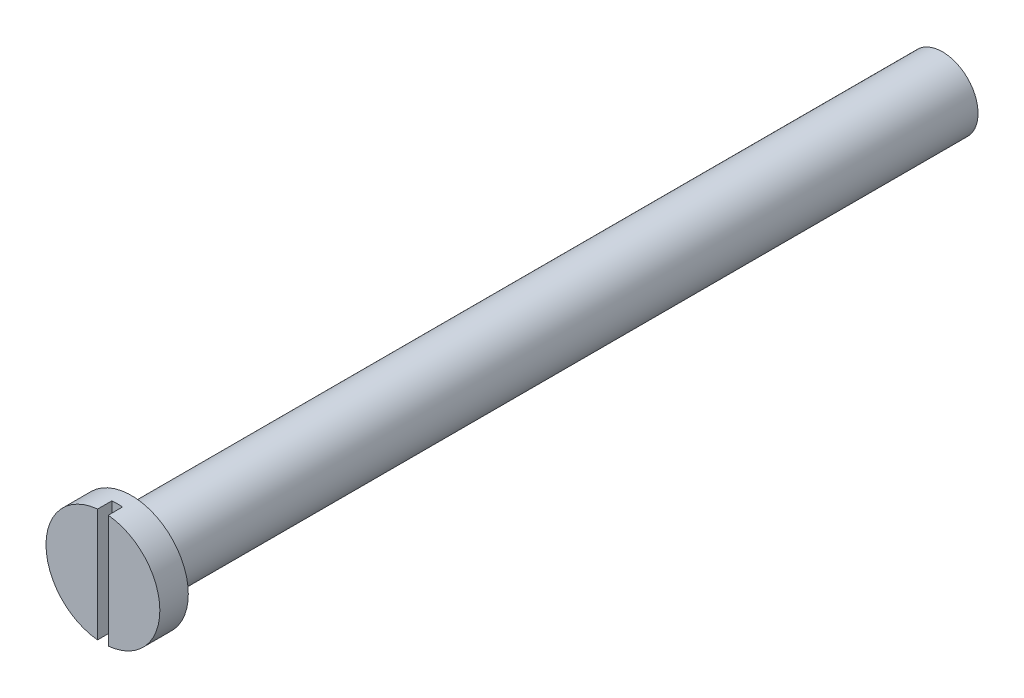
from build123d import *

# Parameters (mm, degrees)
SKETCH_1_R             = 5
EXTRUDE_1_DEPTH        = 114
SKETCH_2_R             = 8
EXTRUDE_2_DEPTH        = 4
SKETCH_4_W             = 1.5
SKETCH_4_H             = 19.56005024
CUT_EXTRUDE_1_DEPTH    = 2
HOLE_WIZARD_M8_1_D     = 6.8
HOLE_WIZARD_M8_1_DEPTH = 15
HOLE_WIZARD_M8_1_TIP   = 2.042926105


with BuildPart() as part:
    # 草图1 → 凸台-拉伸1 (new body)
    with BuildSketch(Plane.XY):
        with Locations(Location((0, 0, 0), (0, 0, 180))):
            Circle(SKETCH_1_R)
    extrude(amount=EXTRUDE_1_DEPTH)

    # 草图2 → 凸台-拉伸2 (add)
    with BuildSketch(Plane.XY.offset(114)):
        Circle(SKETCH_2_R)
    extrude(amount=EXTRUDE_2_DEPTH)

    # 草图4 → 切除-拉伸1 (cut)
    with BuildSketch(Plane.XY.offset(118)):
        Rectangle(SKETCH_4_W, SKETCH_4_H)
    extrude(amount=-CUT_EXTRUDE_1_DEPTH, mode=Mode.SUBTRACT)

    # M8 螺纹孔的螺纹孔钻头1
    with Locations(Plane(origin=(0, 0, 0), x_dir=(-1, 0, 0), z_dir=(0, 0, -1))):
        with Locations((0, 0)):
            Hole(HOLE_WIZARD_M8_1_D / 2, depth=HOLE_WIZARD_M8_1_DEPTH)
            with Locations((0, 0, -(HOLE_WIZARD_M8_1_DEPTH + HOLE_WIZARD_M8_1_TIP / 2))):  # 118° drill point
                Cone(0, HOLE_WIZARD_M8_1_D / 2, HOLE_WIZARD_M8_1_TIP, mode=Mode.SUBTRACT)


solid = part.part
